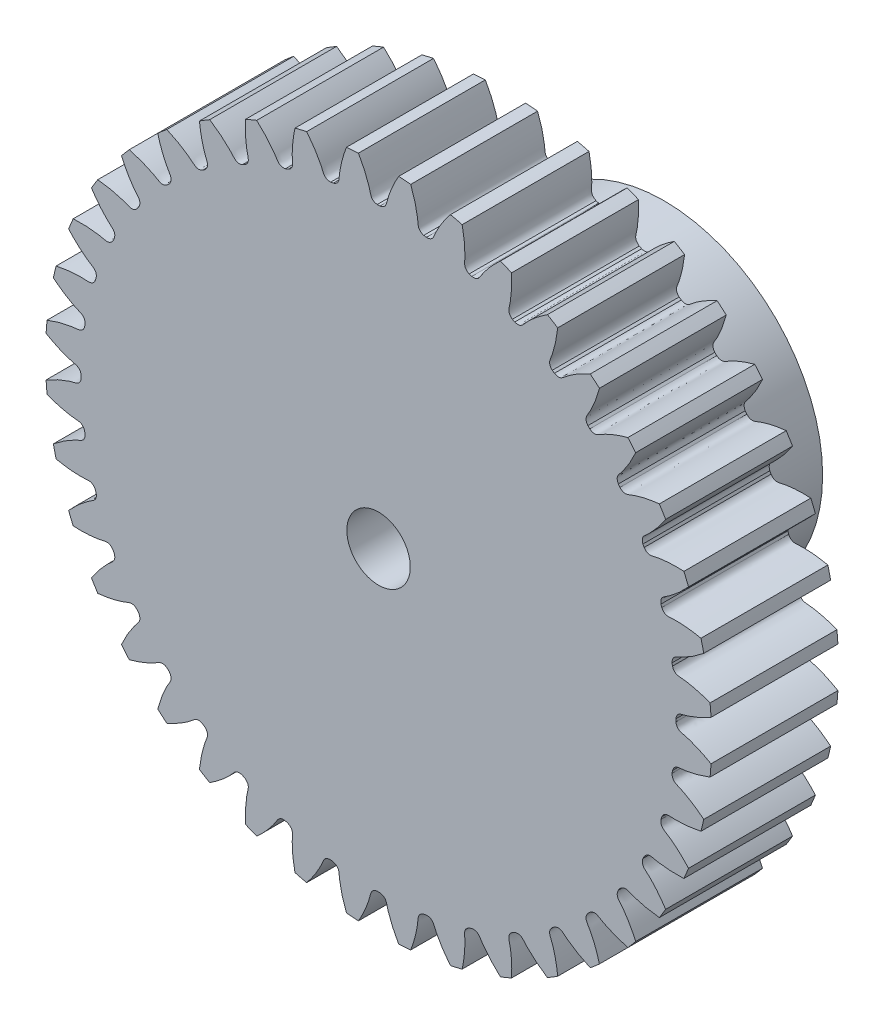
from build123d import *

# Parameters (mm, degrees)
SKETCH_1_R               = 10.5
EXTRUDE_1_DEPTH          = 4
CUT_EXTRUDE_1_DEPTH      = 16.378556499
PATTERN_CIRCULAR_1_COUNT = 40
SKETCH_4_R               = 5
EXTRUDE_2_DEPTH          = 5
SKETCH_5_R               = 1
CUT_EXTRUDE_2_DEPTH      = 18.340577222
CUT_EXTRUDE_3_DEPTH      = 16.642746887
CUT_EXTRUDE_3_DEPTH_BACK = 16.642746887
SKETCH_6_R               = 1
FILLET_1_R               = 1


with BuildPart() as part:
    # 草图1 → 凸台-拉伸1 (new body)
    with BuildSketch(Plane.XY):
        Circle(SKETCH_1_R)
    extrude(amount=EXTRUDE_1_DEPTH)

    # 草图2 → 切除-拉伸1 (cut, through all)
    with BuildSketch(Plane.XY):
        with BuildLine():
            ThreePointArc((0.04229544, 9.374904591), (0, 9.375), (-0.04229544, 9.374904591))
            add(Edge.make_bspline(
                [(-0.04229544, 9.374904591), (-0.227832519, 9.402024548), (-0.244745206, 9.535242738), (-0.283485842, 9.678096908), (-0.296961443, 9.724632721), (-0.312519783, 9.774459625), (-0.330250614, 9.827536672), (-0.350303664, 9.883787953), (-0.372808334, 9.943142627), (-0.397897461, 10.005523075), (-0.425700152, 10.070848462), (-0.456343746, 10.139033766), (-0.489953108, 10.209990132), (-0.526650693, 10.283624847), (-0.5665564, 10.359841427), (-0.609787478, 10.438539676), (-0.656458425, 10.519615757), (-0.70668089, 10.602962258), (-0.760563576, 10.68846827), (-0.818212144, 10.776019459), (-0.879729122, 10.865498146), (-0.94521381, 10.956783383), (-1.014762197, 11.049751043), (-1.088466868, 11.144273897), (-1.166416919, 11.240221704), (-1.248697878, 11.337461301), (-1.335391621, 11.435856694), (-1.426576299, 11.535269149), (-1.522326228, 11.635557291), (-1.657940273, 11.772028055), (-1.764094236, 11.872552232), (-1.837066671, 11.93900679)],
                knots=[0, 0, 0, 0, 0.110656833, 0.124738805, 0.140005423, 0.156456686, 0.174092594, 0.192913148, 0.212918347, 0.234108191, 0.25648268, 0.280041814, 0.304785594, 0.330714019, 0.357827089, 0.386124804, 0.415607165, 0.446274171, 0.478125822, 0.511162118, 0.545383059, 0.580788646, 0.617378878, 0.655153755, 0.694113277, 0.734257445, 0.775586258, 0.818099716, 0.861797819, 0.906680567, 1, 1, 1, 1], degree=3))
            ThreePointArc((-1.837066671, 11.93900679), (0, 12.079515598), (1.837066671, 11.93900679))
            add(Edge.make_bspline(
                [(0.04229544, 9.374904591), (0.227832519, 9.402024548), (0.244745206, 9.535242738), (0.283485842, 9.678096908), (0.296961443, 9.724632721), (0.312519783, 9.774459625), (0.330250614, 9.827536672), (0.350303664, 9.883787953), (0.372808334, 9.943142627), (0.397897461, 10.005523075), (0.425700152, 10.070848462), (0.456343746, 10.139033766), (0.489953108, 10.209990132), (0.526650693, 10.283624847), (0.5665564, 10.359841427), (0.609787478, 10.438539676), (0.656458425, 10.519615757), (0.70668089, 10.602962258), (0.760563576, 10.68846827), (0.818212144, 10.776019459), (0.879729122, 10.865498146), (0.94521381, 10.956783383), (1.014762197, 11.049751043), (1.088466868, 11.144273897), (1.166416919, 11.240221704), (1.248697878, 11.337461301), (1.335391621, 11.435856694), (1.426576299, 11.535269149), (1.522326228, 11.635557291), (1.657940273, 11.772028055), (1.764094236, 11.872552232), (1.837066671, 11.93900679)],
                knots=[0, 0, 0, 0, 0.110656833, 0.124738805, 0.140005423, 0.156456686, 0.174092594, 0.192913148, 0.212918347, 0.234108191, 0.25648268, 0.280041814, 0.304785594, 0.330714019, 0.357827089, 0.386124804, 0.415607165, 0.446274171, 0.478125822, 0.511162118, 0.545383059, 0.580788646, 0.617378878, 0.655153755, 0.694113277, 0.734257445, 0.775586258, 0.818099716, 0.861797819, 0.906680567, 1, 1, 1, 1], degree=3))
        make_face()
    cut_extrude_1 = extrude(amount=CUT_EXTRUDE_1_DEPTH, mode=Mode.SUBTRACT)

    # 阵列(圆周)1: 切除-拉伸1 ×40 about axis
    pattern_circular_1_axis = Axis((0, 0, -0.2), (0, 0, 1))
    for i in range(1, PATTERN_CIRCULAR_1_COUNT):
        add(cut_extrude_1.rotate(pattern_circular_1_axis, i * 360 / PATTERN_CIRCULAR_1_COUNT), mode=Mode.SUBTRACT)

    # 草图4 → 凸台-拉伸2 (add)
    with BuildSketch(Plane(origin=(0, 0, 0), x_dir=(-1, 0, 0), z_dir=(0, 0, -1))):
        Circle(SKETCH_4_R)
    extrude(amount=EXTRUDE_2_DEPTH)

    # 草图5 → 切除-拉伸2 (cut, through all)
    with BuildSketch(Plane(origin=(0, 0, -5), x_dir=(-1, 0, 0), z_dir=(0, 0, -1))):
        Circle(SKETCH_5_R)
    extrude(amount=-CUT_EXTRUDE_2_DEPTH, mode=Mode.SUBTRACT)

    # 草图6 → 切除-拉伸3 (cut, two sides: drawn at the far end of the back side and taken through both)
    with BuildSketch(Plane(origin=(0, 0, 0), x_dir=(1, 0, 0), z_dir=(0, 1, 0)).offset(-CUT_EXTRUDE_3_DEPTH_BACK)):
        with Locations((0, 2.5)):
            Circle(SKETCH_6_R)
    extrude(amount=CUT_EXTRUDE_3_DEPTH + CUT_EXTRUDE_3_DEPTH_BACK, mode=Mode.SUBTRACT)

    # 圆角1
    fillet_1_edges = [part.edges().sort_by_distance(p)[0] for p in [
        (5, 0, 0),
    ]]
    fillet(fillet_1_edges, radius=FILLET_1_R)


solid = part.part
